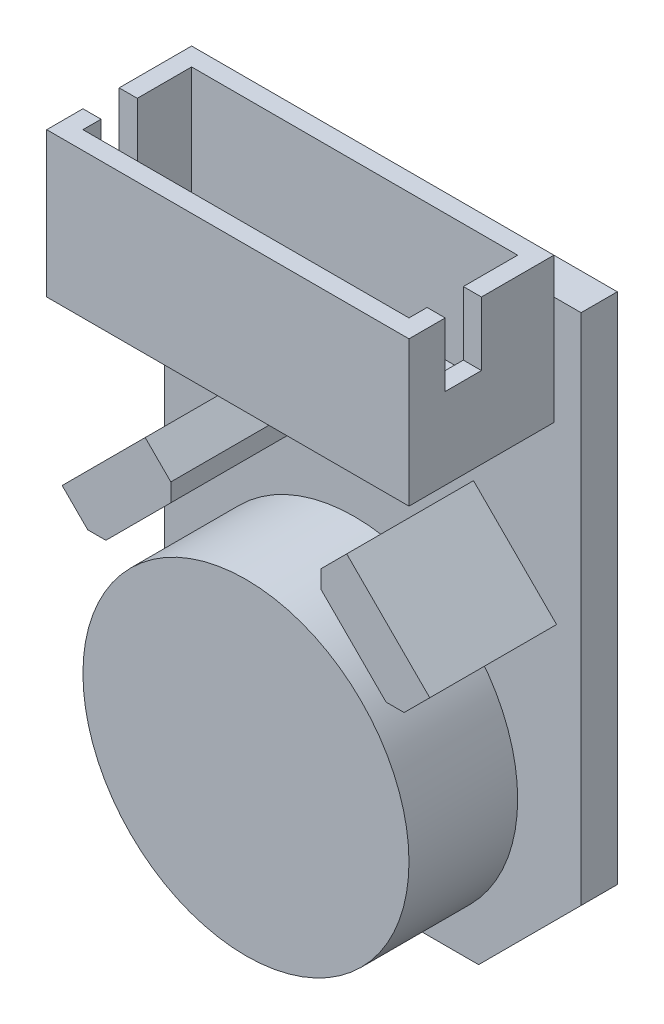
from build123d import *

# Parameters (mm, degrees)
SALIENTE_EXTRUIR1_DEPTH = 1
SALIENTE_EXTRUIR2_DEPTH = 3.5
CROQUIS3_R              = 0.25
SALIENTE_EXTRUIR3_DEPTH = 4.5
CROQUIS4_R              = 4.5
SALIENTE_EXTRUIR4_DEPTH = 3
CROQUIS5_W              = 10
CROQUIS5_H              = 4
SALIENTE_EXTRUIR5_DEPTH = 4
CROQUIS6_W              = 9
CROQUIS6_H              = 3
CORTAR_EXTRUIR1_DEPTH   = 3.5
CROQUIS7_W              = 1
CROQUIS7_H              = 2
CORTAR_EXTRUIR2_DEPTH   = 16.192514604


with BuildPart() as part:
    # Croquis1 → Saliente-Extruir1 (new body)
    with BuildSketch(Plane.XY):
        Polygon((-5.75, -5.671572875), (-2.921572875, -8.5), (2.921572875, -8.5), (5.75, -5.671572875), (5.75, 8.5), (-5.75, 8.5), align=None)
    extrude(amount=SALIENTE_EXTRUIR1_DEPTH)

    # Croquis2 → Saliente-Extruir2 (add)
    with BuildSketch(Plane.XY.offset(1)):
        Polygon((-2.780902327, 3), (-5.073795546, 0.707106781), (-4.366688764, 0), (-3.866688764, 0), (-2.073795546, 1.792893219), (-2.073795546, 2.292893219), align=None)
        Polygon((2.073795546, 1.792893219), (2.073795546, 2.292893219), (2.780902327, 3), (5.073795546, 0.707106781), (4.366688764, 0), (3.866688764, 0), align=None)
    extrude(amount=SALIENTE_EXTRUIR2_DEPTH)

    # Croquis3 → Saliente-Extruir3 (add)
    with BuildSketch(Plane.XY):
        with Locations(Location((0, -3.5, 0), (0, 0, 180))):
            Circle(CROQUIS3_R)
    extrude(amount=SALIENTE_EXTRUIR3_DEPTH)

    # Croquis4 → Saliente-Extruir4 (add)
    with BuildSketch(Plane.XY.offset(4.5)):
        with Locations((0, -3.5)):
            Circle(CROQUIS4_R)
    extrude(amount=-SALIENTE_EXTRUIR4_DEPTH)

    # Croquis5 → Saliente-Extruir5 (add)
    with BuildSketch(Plane.XY.offset(1)):
        with Locations((0, 7.5)):
            Rectangle(CROQUIS5_W, CROQUIS5_H)
    extrude(amount=SALIENTE_EXTRUIR5_DEPTH)

    # Croquis6 → Cortar-Extruir1 (cut)
    with BuildSketch(Plane(origin=(0, 9.5, 0), x_dir=(1, 0, 0), z_dir=(0, 1, 0))):
        with Locations((0, -3)):
            Rectangle(CROQUIS6_W, CROQUIS6_H)
    extrude(amount=-CORTAR_EXTRUIR1_DEPTH, mode=Mode.SUBTRACT)

    # Croquis7 → Cortar-Extruir2 (cut, through all)
    with BuildSketch(Plane(origin=(5, 0, 0), x_dir=(0, 0, -1), z_dir=(1, 0, 0))):
        with Locations((-3.5, 8.741122999)):
            Rectangle(CROQUIS7_W, CROQUIS7_H)
    extrude(amount=-CORTAR_EXTRUIR2_DEPTH, mode=Mode.SUBTRACT)


solid = part.part
